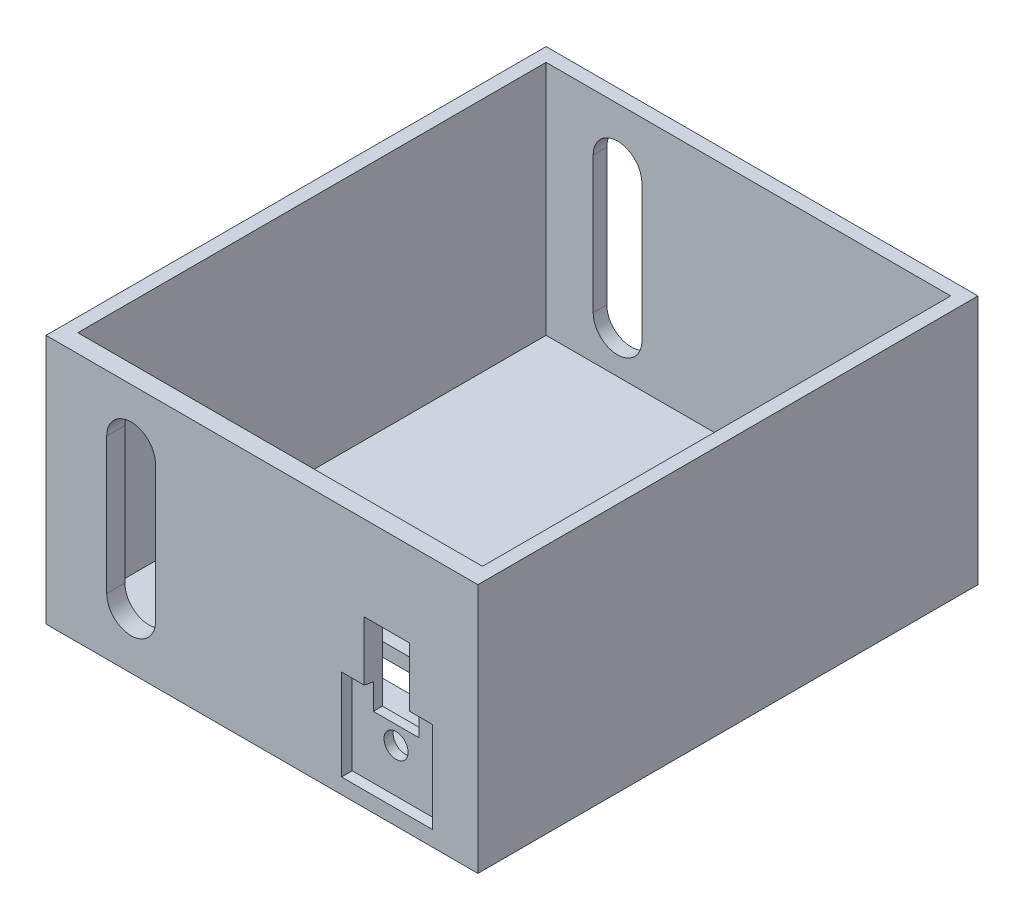
from build123d import *

# Parameters (mm, degrees)
SKETCH_196_W        = 95
SKETCH_196_H        = 55
EXTRUDE_2_DEPTH     = 110
SKETCH_556_W        = 89
SKETCH_556_H        = 103
CUT_EXTRUDE_1_DEPTH = 52
SKETCH_4_W          = 10
SKETCH_4_H          = 19
CUT_EXTRUDE_2_DEPTH = 10
SKETCH_5_R          = 2.65
CUT_EXTRUDE_3_DEPTH = 10
SKETCH_6_W          = 20
SKETCH_6_H          = 20
CUT_EXTRUDE_4_DEPTH = 2
CUT_EXTRUDE_4_DRAFT = -10
SKETCH_7_R          = 2.65
CUT_EXTRUDE_5_DEPTH = 5
CUT_EXTRUDE_6_DEPTH = 130


with BuildPart() as part:
    # Sketch 196 → 凸台-拉伸2 (new body)
    with BuildSketch(Plane.XY):
        with Locations((9.731535207, -3.335016835)):
            Rectangle(SKETCH_196_W, SKETCH_196_H)
    extrude(amount=-EXTRUDE_2_DEPTH)

    # Sketch 556 → 切除-拉伸1 (cut)
    with BuildSketch(Plane(origin=(0, 24.164983165, 0), x_dir=(1, 0, 0), z_dir=(0, 1, 0))):
        with Locations((9.731535207, 55.5)):
            Rectangle(SKETCH_556_W, SKETCH_556_H)
    extrude(amount=-CUT_EXTRUDE_1_DEPTH, mode=Mode.SUBTRACT)

    # 铝材侧<4> → 切除-拉伸2 (cut)
    with BuildSketch(Plane.XY):
        with Locations((37.231535207, -3.968013468)):
            Rectangle(SKETCH_4_W, SKETCH_4_H)
    extrude(amount=-CUT_EXTRUDE_2_DEPTH, mode=Mode.SUBTRACT)

    # 铝材侧<5> → 切除-拉伸3 (cut)
    with BuildSketch(Plane.XY):
        with Locations((37.231535207, -17.468013468)):
            Circle(SKETCH_5_R)
    extrude(amount=-CUT_EXTRUDE_3_DEPTH, mode=Mode.SUBTRACT)


with BuildPart() as cut_extrude_4_tool:
    # 铝材侧<6> → 切除-拉伸4 (with draft: the straight prism first)
    with BuildSketch(Plane.XY):
        with Locations((37.231535207, -17.468013468)):
            Rectangle(SKETCH_6_W, SKETCH_6_H)
    extrude(amount=-CUT_EXTRUDE_4_DEPTH)
    # 切除-拉伸4: the draft: its side faces are tilted about the plane it starts from
    cut_extrude_4_sides = [cut_extrude_4_tool.faces().sort_by_distance(p)[0] for p in [
        (27.231535207, -17.468013468, -1),
        (37.231535207, -27.468013468, -1),
        (47.231535207, -17.468013468, -1),
        (37.231535207, -7.468013468, -1),
    ]]
    draft(cut_extrude_4_sides, Plane.XY, CUT_EXTRUDE_4_DRAFT)


with BuildPart() as part_1:
    add(part.part)

    # 切除-拉伸4: cut by cut_extrude_4_tool
    add(cut_extrude_4_tool.part, mode=Mode.SUBTRACT)

    # 草图7 → 切除-拉伸5 (cut)
    with BuildSketch(Plane.XZ.offset(30.835016835)):
        with Locations((9.731535207, -55)):
            Circle(SKETCH_7_R)
        with BuildLine():
            Line((-12.711989835, -23.70260728), (32.17506025, -23.70260728))
            ThreePointArc((32.17506025, -23.70260728), (35.675426541, -27.202973571), (32.17506025, -30.703339862))
            Line((32.17506025, -30.703339862), (-12.711989835, -30.703339862))
            ThreePointArc((-12.711989835, -30.703339862), (-16.212356126, -27.202973571), (-12.711989835, -23.70260728))
        make_face()
    extrude(amount=-CUT_EXTRUDE_5_DEPTH, mode=Mode.SUBTRACT)

    # 草图8 → 切除-拉伸6 (cut)
    with BuildSketch(Plane(origin=(0, 0, -110), x_dir=(-1, 0, 0), z_dir=(0, 0, -1))):
        with BuildLine():
            Line((24.415116535, 11.664983165), (24.415116535, -18.335016835))
            ThreePointArc((24.415116535, -18.335016835), (19.056084672, -23.694048698), (13.697052809, -18.335016835))
            Line((13.697052809, -18.335016835), (13.697052809, 11.664983165))
            ThreePointArc((13.697052809, 11.664983165), (19.056084672, 17.024015028), (24.415116535, 11.664983165))
        make_face()
    extrude(amount=-CUT_EXTRUDE_6_DEPTH, mode=Mode.SUBTRACT)


solid = part_1.part
